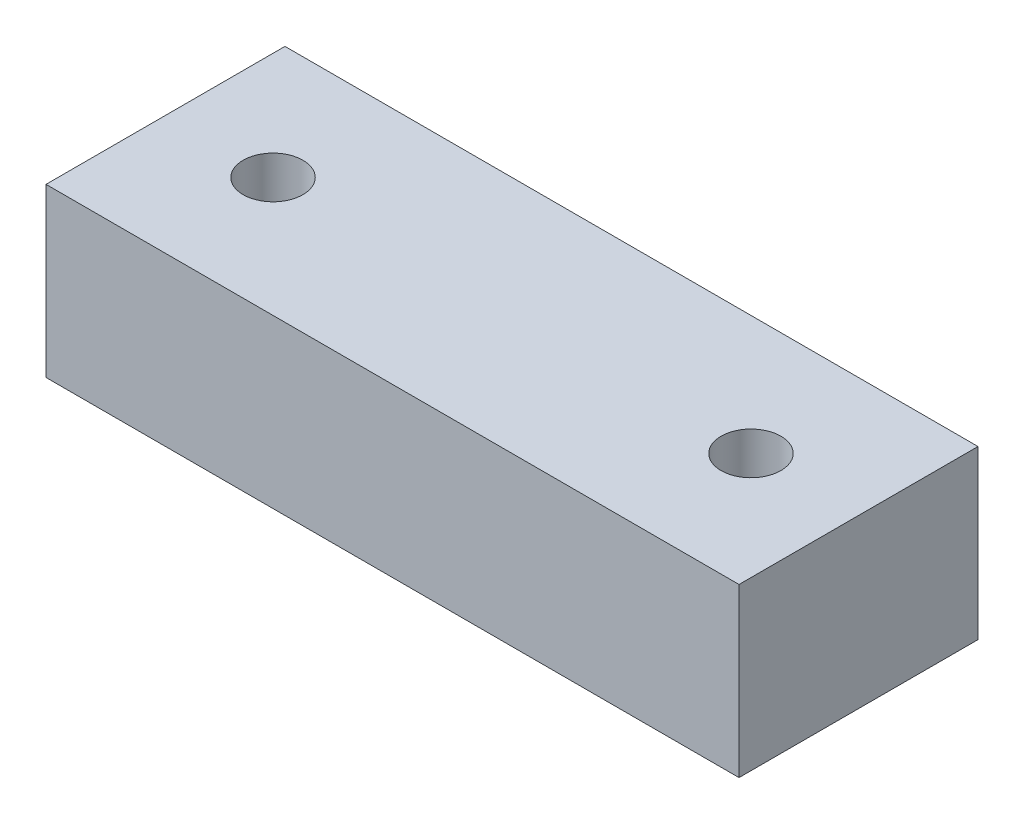
from build123d import *

# Parameters (mm, degrees)
SKETCH1_W           = 36.83
SKETCH1_H           = 12.7
SKETCH1_R           = 1.5875
BOSS_EXTRUDE1_DEPTH = 8.89


with BuildPart() as part:
    # Sketch1 → Boss-Extrude1 (new body)
    with BuildSketch(Plane(origin=(0, 0, 0), x_dir=(1, 0, 0), z_dir=(0, 1, 0))):
        with Locations((18.415, -6.35)):
            Rectangle(SKETCH1_W, SKETCH1_H)
        with Locations(Location((5.715, -6.35, 0), (0, 0, 270))):
            Circle(SKETCH1_R, mode=Mode.SUBTRACT)
        with Locations(Location((31.115, -6.35, 0), (0, 0, 270))):
            Circle(SKETCH1_R, mode=Mode.SUBTRACT)
    extrude(amount=BOSS_EXTRUDE1_DEPTH)


solid = part.part
